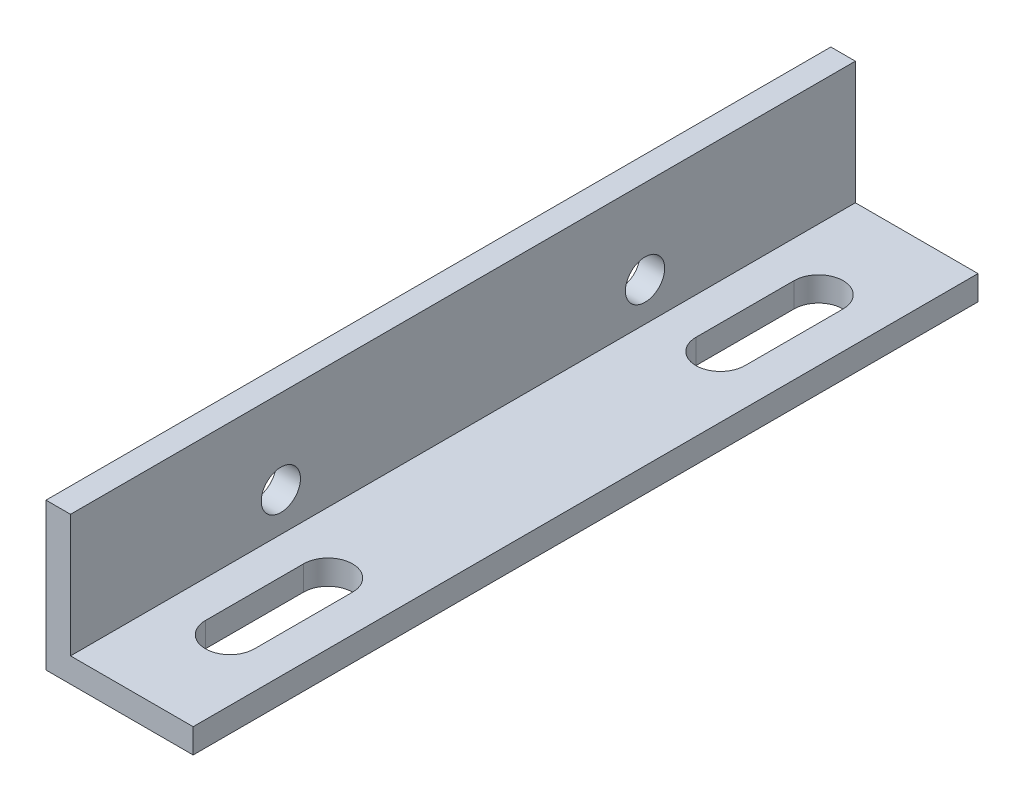
from build123d import *

# Parameters (mm, degrees)
EXTRUDE1_DEPTH     = 50.8
CUT_EXTRUDE1_DEPTH = 70.3077329
SKETCH4_R          = 2.54
CUT_EXTRUDE2_DEPTH = 65.578023899


with BuildPart() as part:
    # Sketch1 → Extrude1 (new, symmetric)
    with BuildSketch(Plane.XY.offset(3.146668532)):
        Polygon((21.463, 31.75), (21.463, 12.7), (40.513, 12.7), (40.513, 15.875), (24.638, 15.875), (24.638, 31.75), align=None)
    extrude(amount=EXTRUDE1_DEPTH, both=True)

    # Sketch3 → Cut-Extrude1 (cut, through all)
    with BuildSketch(Plane(origin=(0, 15.875, 0), x_dir=(-1, 0, 0), z_dir=(0, 1, 0))):
        with BuildLine():
            Line((-35.7505, -34.953331468), (-35.7505, -22.253331468))
            ThreePointArc((-35.7505, -22.253331468), (-32.5755, -19.078331468), (-29.4005, -22.253331468))
            Line((-29.4005, -22.253331468), (-29.4005, -34.953331468))
            ThreePointArc((-29.4005, -34.953331468), (-32.5755, -38.128331468), (-35.7505, -34.953331468))
        make_face()
        with BuildLine():
            Line((-29.4005, 41.246668532), (-29.4005, 28.546668532))
            ThreePointArc((-29.4005, 28.546668532), (-32.5755, 25.371668532), (-35.7505, 28.546668532))
            Line((-35.7505, 28.546668532), (-35.7505, 41.246668532))
            ThreePointArc((-35.7505, 41.246668532), (-32.5755, 44.421668532), (-29.4005, 41.246668532))
        make_face()
    extrude(amount=-CUT_EXTRUDE1_DEPTH, mode=Mode.SUBTRACT)

    # Sketch4 → Cut-Extrude2 (cut, through all)
    with BuildSketch(Plane(origin=(24.638, 0, 0), x_dir=(0, 0, -1), z_dir=(1, 0, 0))):
        with Locations((20.424531468, 20.8788)):
            Circle(SKETCH4_R)
        with Locations((-26.717868532, 20.8788)):
            Circle(SKETCH4_R)
    extrude(amount=-CUT_EXTRUDE2_DEPTH, mode=Mode.SUBTRACT)


solid = part.part
